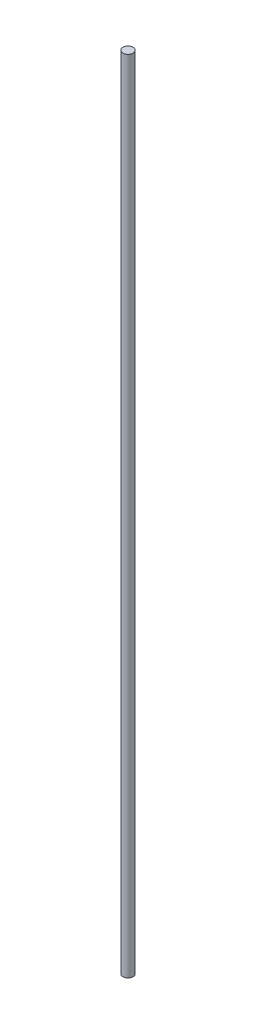
from build123d import *

# Parameters (mm, degrees)
BOSS_EXTRUDE1_DEPTH      = 195
BOSS_EXTRUDE1_DEPTH_BACK = 195
SKETCH1_R                = 2.5


with BuildPart() as part:
    # Sketch1 → Boss-Extrude1 (new, two sides: drawn at the far end of the back side and taken through both)
    with BuildSketch(Plane(origin=(0, 0, 0), x_dir=(1, 0, 0), z_dir=(0, 1, 0)).offset(-BOSS_EXTRUDE1_DEPTH_BACK)):
        Circle(SKETCH1_R)
    extrude(amount=BOSS_EXTRUDE1_DEPTH + BOSS_EXTRUDE1_DEPTH_BACK)


solid = part.part
